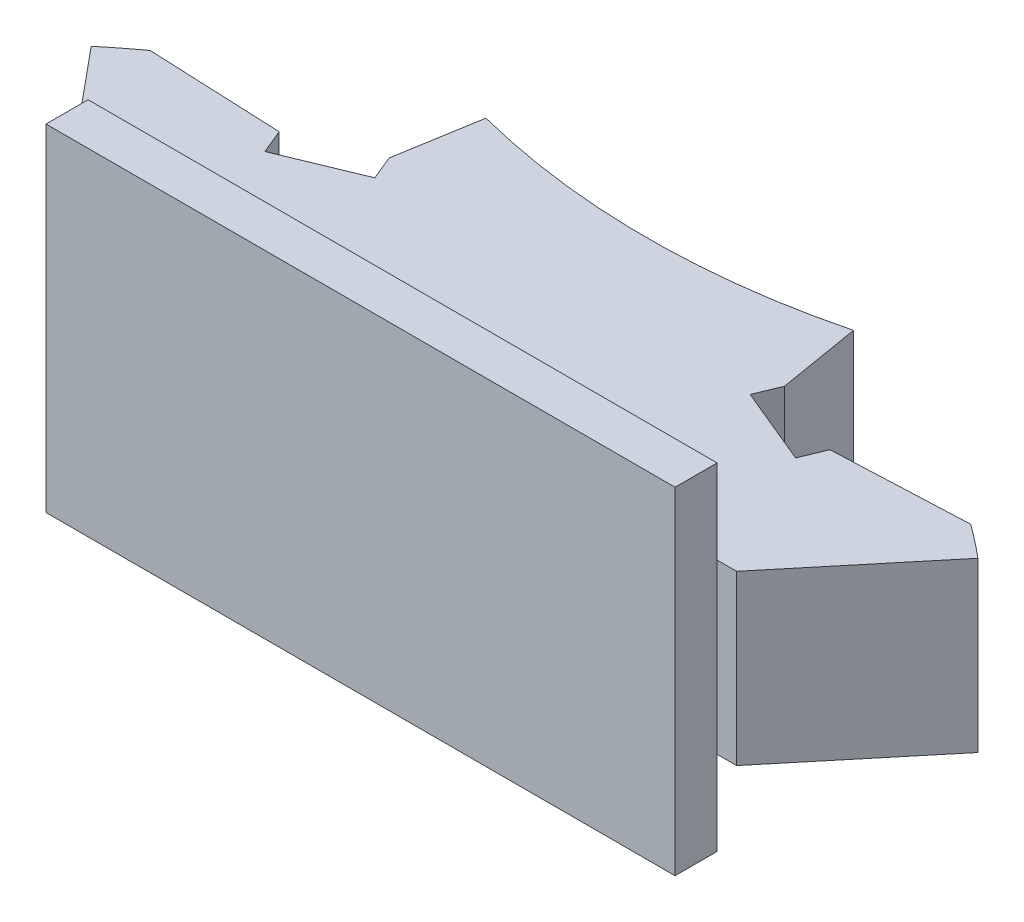
from build123d import *

# Parameters (mm, degrees)
BOSS_EXTRUDE1_DEPTH = 12.7
SKETCH1_5_W         = 47.483470806
SKETCH1_5_H         = 3.175
BOSS_EXTRUDE2_DEPTH = 6.35
SKETCH1_6_W         = 47.483470806
SKETCH1_6_H         = 3.175
BOSS_EXTRUDE3_DEPTH = 19.05


with BuildPart() as part:
    # Sketch1 → Boss-Extrude1 (new body)
    with BuildSketch(Plane(origin=(0, 0, 0), x_dir=(1, 0, 0), z_dir=(0, 1, 0))):
        with BuildLine():
            Line((25.211738376, 30.418429692), (33.470890643, 40.38325))
            ThreePointArc((33.470890643, 40.38325), (32.233303271, 41.377790676), (30.966181765, 42.334418478))
            Line((30.966181765, 42.334418478), (20.788013819, 41.890030069))
            Line((20.788013819, 41.890030069), (20.029841402, 40.059639939))
            Line((20.029841402, 40.059639939), (14.163206371, 42.489679735))
            Line((14.163206371, 42.489679735), (14.921378787, 44.320069864))
            Line((14.921378787, 44.320069864), (13.87332649, 50.582983434))
            ThreePointArc((13.87332649, 50.582983434), (0, 48.833429692), (-13.87332649, 50.582983434))
            Line((-13.87332649, 50.582983434), (-14.921378787, 44.320069864))
            Line((-14.921378787, 44.320069864), (-14.163206371, 42.489679735))
            Line((-14.163206371, 42.489679735), (-20.029841402, 40.059639939))
            Line((-20.029841402, 40.059639939), (-20.788013819, 41.890030069))
            Line((-20.788013819, 41.890030069), (-30.966181765, 42.334418478))
            ThreePointArc((-30.966181765, 42.334418478), (-32.233303271, 41.377790676), (-33.470890643, 40.38325))
            Line((-33.470890643, 40.38325), (-25.211738376, 30.418429692))
            Line((-25.211738376, 30.418429692), (25.211738376, 30.418429692))
        make_face()
    extrude(amount=-BOSS_EXTRUDE1_DEPTH)



with BuildPart() as body_2:
    # Sketch1<5> → Boss-Extrude2 (new body)
    with BuildSketch(Plane(origin=(0, 0, 0), x_dir=(1, 0, 0), z_dir=(0, 1, 0))):
        with Locations((0, 28.830929692)):
            Rectangle(SKETCH1_5_W, SKETCH1_5_H)
    extrude(amount=BOSS_EXTRUDE2_DEPTH)


with BuildPart() as part_1:
    add(part.part)

    add(body_2.part)  # Boss-Extrude3 merges body 2
    # Sketch1<6> → Boss-Extrude3 (add)
    with BuildSketch(Plane(origin=(0, 0, 0), x_dir=(1, 0, 0), z_dir=(0, 1, 0))):
        with Locations((0, 28.830929692)):
            Rectangle(SKETCH1_6_W, SKETCH1_6_H)
    extrude(amount=-BOSS_EXTRUDE3_DEPTH)


solid = part_1.part
